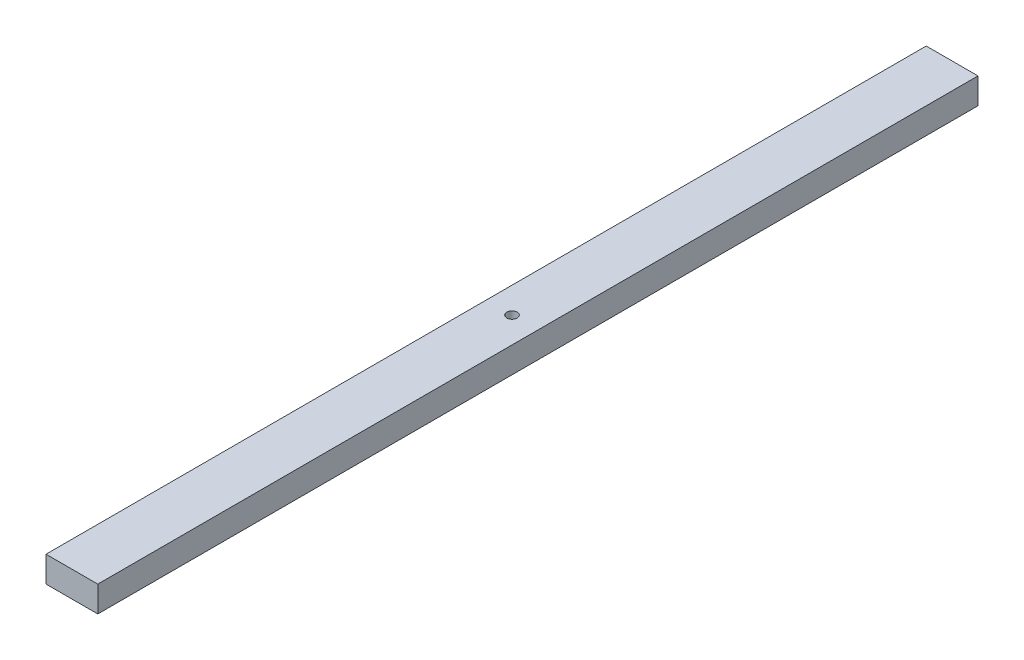
from build123d import *

# Parameters (mm, degrees)
ESQUISSE1_W             = 100
ESQUISSE1_H             = 50
BOSS_EXTRU_1_DEPTH      = 1700
ESQUISSE2_R             = 10
ENL_V_MAT_EXTRU_1_DEPTH = 1704.67250374


with BuildPart() as part:
    # Esquisse1 → Boss.-Extru.1 (new body)
    with BuildSketch(Plane.XY):
        with Locations((50, 25)):
            Rectangle(ESQUISSE1_W, ESQUISSE1_H)
    extrude(amount=BOSS_EXTRU_1_DEPTH)

    # Esquisse2 → Enlèv. mat.-Extru.1 (cut, through all)
    with BuildSketch(Plane.XZ):
        with Locations(Location((50, 850, 0), (0, 0, 270))):
            Circle(ESQUISSE2_R)
    extrude(amount=-ENL_V_MAT_EXTRU_1_DEPTH, mode=Mode.SUBTRACT)


solid = part.part
